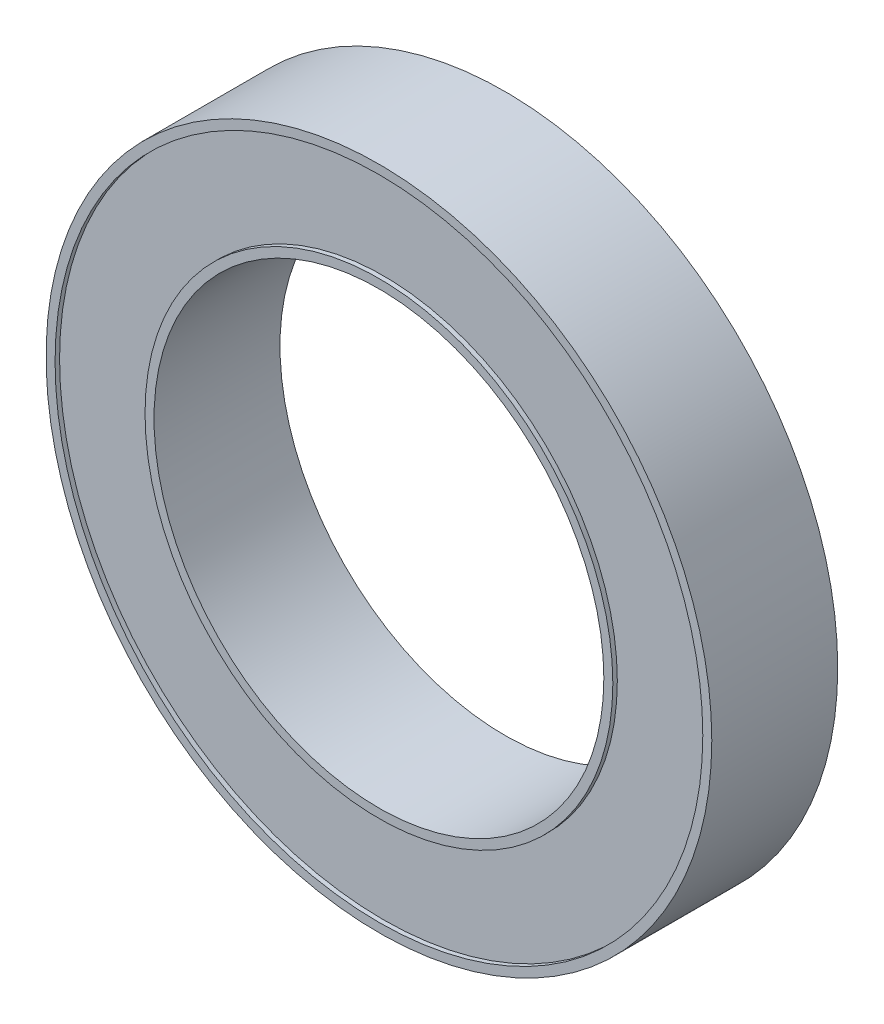
from build123d import *

# Parameters (mm, degrees)
SKETCH1_R           = 18.5
SKETCH1_R_2         = 12.5
BOSS_EXTRUDE1_DEPTH = 3.5
SKETCH2_R           = 18
SKETCH2_R_2         = 13
CUT_EXTRUDE1_DEPTH  = 0.25


with BuildPart() as part:
    # Sketch1 → Boss-Extrude1 (new, symmetric)
    with BuildSketch(Plane.XY):
        Circle(SKETCH1_R)
        Circle(SKETCH1_R_2, mode=Mode.SUBTRACT)
    extrude(amount=BOSS_EXTRUDE1_DEPTH, both=True)

    # Sketch2 → Cut-Extrude1 (cut)
    with BuildSketch(Plane.XY.offset(3.5)):
        Circle(SKETCH2_R)
        Circle(SKETCH2_R_2, mode=Mode.SUBTRACT)
    cut_extrude1 = extrude(amount=-CUT_EXTRUDE1_DEPTH, mode=Mode.SUBTRACT)

    # Mirror1: Cut-Extrude1 across plane
    add(cut_extrude1.mirror(Plane.XY), mode=Mode.SUBTRACT)


solid = part.part
